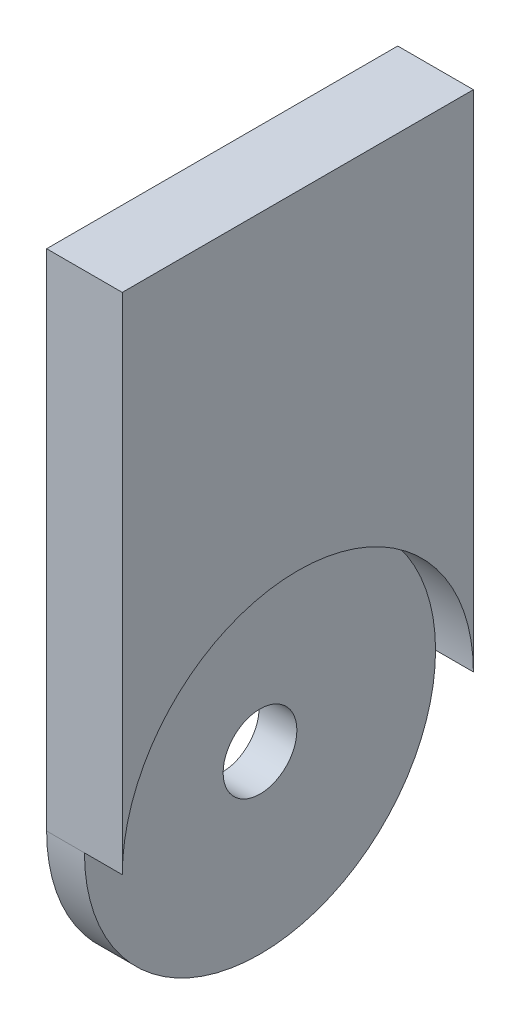
from build123d import *

# Parameters (mm, degrees)
ESQUISSE1_W             = 27.85
ESQUISSE1_H             = 40
BOSS_EXTRU_1_DEPTH      = 6
ENL_V_START             = -3
ESQUISSE2_R             = 13.925
ENL_V_MAT_EXTRU_1_DEPTH = 3
ESQUISSE3_R             = 2.925
ENL_V_MAT_EXTRU_2_DEPTH = 10


with BuildPart() as part:
    # Esquisse1 → Boss.-Extru.1 (new body)
    with BuildSketch(Plane(origin=(0, 0, 0), x_dir=(0, 0, -1), z_dir=(1, 0, 0))):
        with Locations((-1.440517241, 18.893965517)):
            Rectangle(ESQUISSE1_W, ESQUISSE1_H)
        with BuildLine():
            ThreePointArc((12.484482759, -1.106034483), (-1.440517241, -15.031034483), (-15.365517241, -1.106034483))
            Line((-15.365517241, -1.106034483), (12.484482759, -1.106034483))
        make_face()
    extrude(amount=BOSS_EXTRU_1_DEPTH)

    # Esquisse2 → Enlèv. mat.-Extru.1 (cut)
    with BuildSketch(Plane(origin=(6, 0, 0), x_dir=(0, 0, -1), z_dir=(1, 0, 0)).offset(ENL_V_START)):
        with Locations((-1.440517241, -1.106034483)):
            Circle(ESQUISSE2_R)
    extrude(amount=ENL_V_MAT_EXTRU_1_DEPTH, mode=Mode.SUBTRACT)

    # Esquisse3 → Enlèv. mat.-Extru.2 (cut)
    with BuildSketch(Plane.ZY):
        with Locations((1.440517241, -1.106034483)):
            Circle(ESQUISSE3_R)
    extrude(amount=-ENL_V_MAT_EXTRU_2_DEPTH, mode=Mode.SUBTRACT)


solid = part.part
